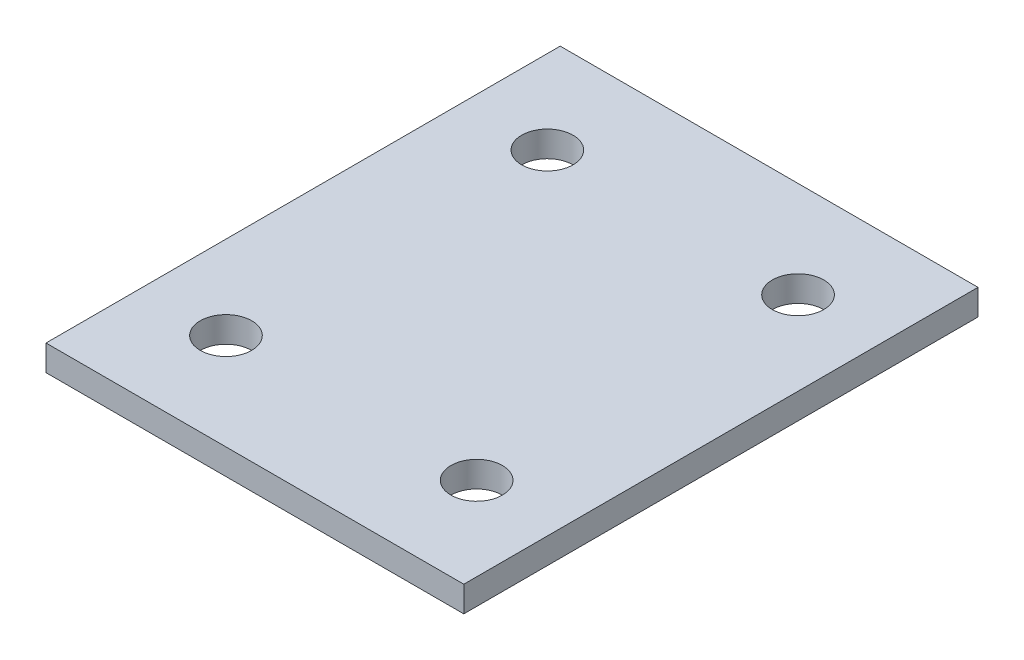
from build123d import *

# Parameters (mm, degrees)
SKETCH1_W           = 65
SKETCH1_H           = 80
SKETCH1_R           = 4
BOSS_EXTRUDE1_DEPTH = 4


with BuildPart() as part:
    # Sketch1 → Boss-Extrude1 (new body)
    with BuildSketch(Plane(origin=(0, 0, 0), x_dir=(1, 0, 0), z_dir=(0, 1, 0))):
        with Locations((32.5, 40)):
            Rectangle(SKETCH1_W, SKETCH1_H)
        with Locations(Location((13, 65, 0), (0, 0, 270))):
            Circle(SKETCH1_R, mode=Mode.SUBTRACT)
        with Locations(Location((13, 15, 0), (0, 0, 90))):
            Circle(SKETCH1_R, mode=Mode.SUBTRACT)
        with Locations(Location((52, 15, 0), (0, 0, 270))):
            Circle(SKETCH1_R, mode=Mode.SUBTRACT)
        with Locations(Location((52, 65, 0), (0, 0, 90))):
            Circle(SKETCH1_R, mode=Mode.SUBTRACT)
    extrude(amount=BOSS_EXTRUDE1_DEPTH)


solid = part.part
